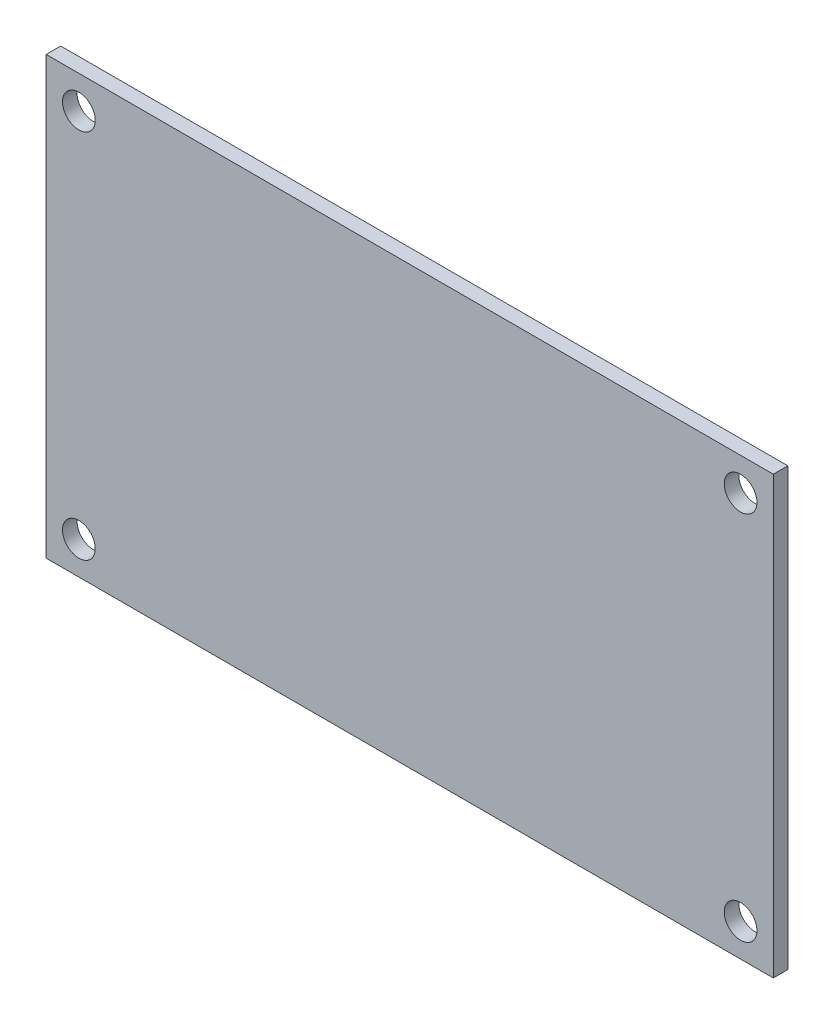
from build123d import *

# Parameters (mm, degrees)
SKETCH1_W            = 100
SKETCH1_H            = 60
BOSS_EXTRUDE1_DEPTH  = 2
M4_CLEARANCE_HOLE1_D = 4.5


with BuildPart() as part:
    # Sketch1 → Boss-Extrude1 (new body)
    with BuildSketch(Plane.XY):
        Rectangle(SKETCH1_W, SKETCH1_H)
    extrude(amount=BOSS_EXTRUDE1_DEPTH)

    # M4 Clearance Hole1 (through all)
    with Locations(Plane(origin=(-45.5, 25.5, 2), x_dir=(1, 0, 0), z_dir=(0, 0, 1))):
        with Locations((0, 0), (0, -51), (91, -51), (91, 0)):
            Hole(M4_CLEARANCE_HOLE1_D / 2)


solid = part.part
